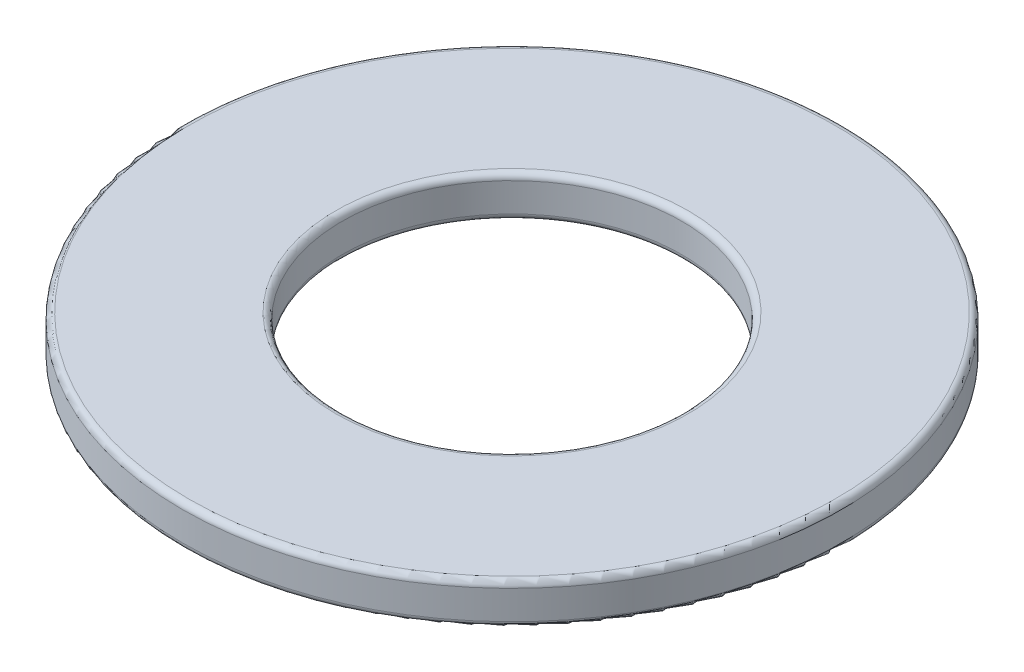
from build123d import *

# Parameters (mm, degrees)
SKETCH1_R           = 8
SKETCH1_R_2         = 4.125
BOSS_EXTRUDE1_DEPTH = 0.5
FILLET1_R           = 0.15


with BuildPart() as part:
    # Sketch1 → Boss-Extrude1 (new, symmetric)
    with BuildSketch(Plane(origin=(0, 0, 0), x_dir=(1, 0, 0), z_dir=(0, 1, 0))):
        with Locations(Location((0, 0, 0), (0, 0, 270))):
            Circle(SKETCH1_R)
        with Locations(Location((0, 0, 0), (0, 0, 270))):
            Circle(SKETCH1_R_2, mode=Mode.SUBTRACT)
    extrude(amount=BOSS_EXTRUDE1_DEPTH, both=True)

    # Fillet1
    fillet1_edges = [part.edges().sort_by_distance(p)[0] for p in [
        (0, -0.5, -8),
        (0, 0.5, -8),
        (0, -0.5, -4.125),
        (0, 0.5, -4.125),
    ]]
    fillet(fillet1_edges, radius=FILLET1_R)


solid = part.part
